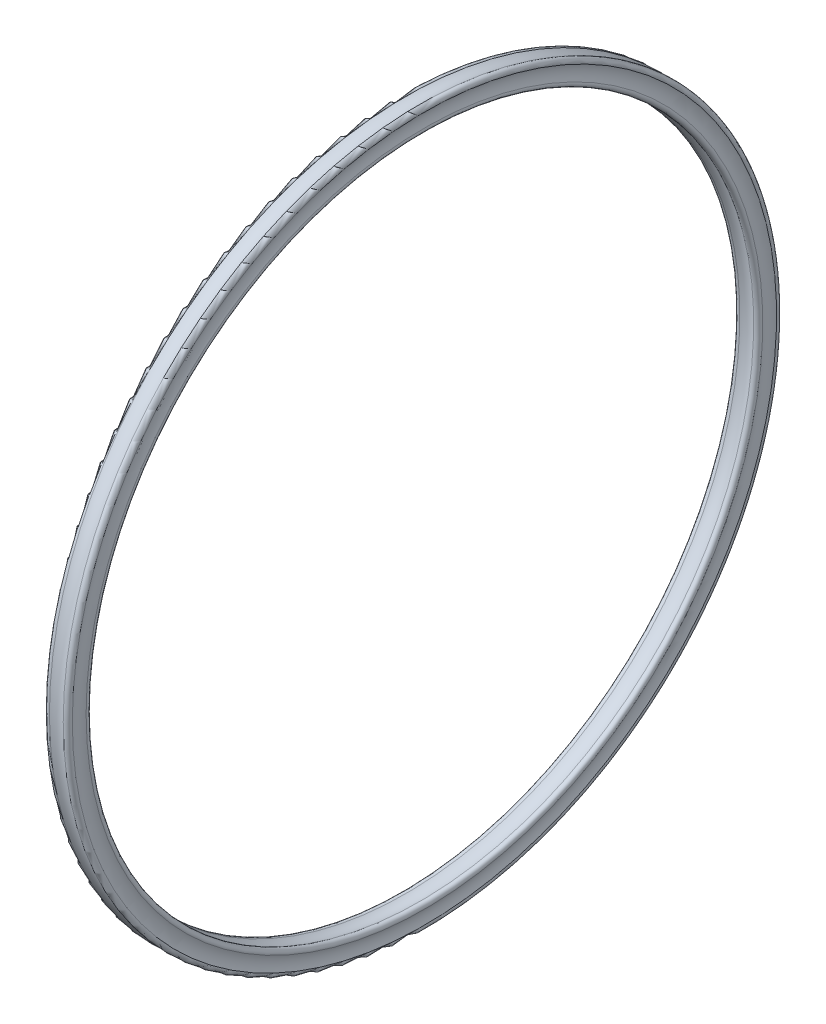
from build123d import *


with BuildPart() as part:
    # Sketch1 → Revolve1 (revolve)
    with BuildSketch(Plane.XY, mode=Mode.PRIVATE) as revolve1_sk:
        with BuildLine():
            ThreePointArc((-0.86657475, 26.672204285), (-0.75565, 26.1493), (-0.86657475, 25.626395715))
            ThreePointArc((-0.86657475, 25.626395715), (-0.812735857, 25.336564143), (-0.522904285, 25.28272525))
            ThreePointArc((-0.522904285, 25.28272525), (0, 25.39365), (0.522904285, 25.28272525))
            ThreePointArc((0.522904285, 25.28272525), (0.812735857, 25.336564143), (0.86657475, 25.626395715))
            ThreePointArc((0.86657475, 25.626395715), (0.75565, 26.1493), (0.86657475, 26.672204285))
            ThreePointArc((0.86657475, 26.672204285), (0.812735857, 26.962035857), (0.522904285, 27.01587475))
            ThreePointArc((0.522904285, 27.01587475), (0, 26.90495), (-0.522904285, 27.01587475))
            ThreePointArc((-0.522904285, 27.01587475), (-0.812735857, 26.962035857), (-0.86657475, 26.672204285))
        make_face()
    revolve(revolve1_sk.sketch.rotate(Axis((-0.889, 0, 0), (1, 0, 0)), 90), axis=Axis((-0.889, 0, 0), (1, 0, 0)))


solid = part.part
